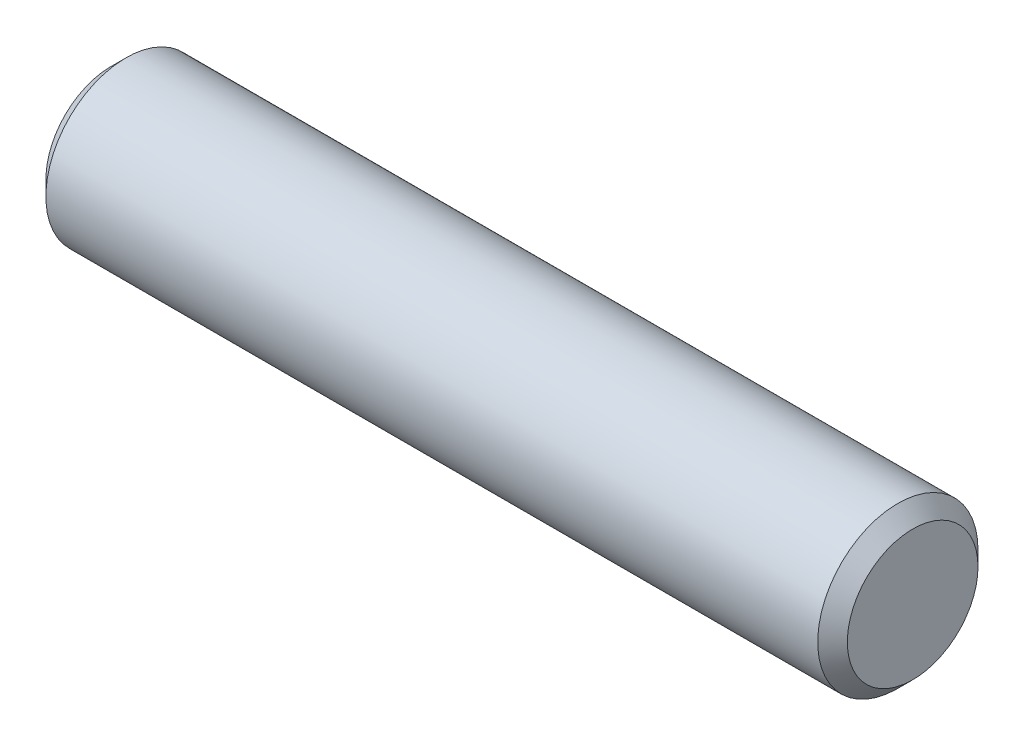
from build123d import *

# Parameters (mm, degrees)
BODYSKE_W     = 30
BODYSKE_H     = 3
CHAMFER1_SIZE = 0.5545


with BuildPart() as part:
    # BodySke → BaseBody (revolve)
    with BuildSketch(Plane.XY, mode=Mode.PRIVATE) as basebody_sk:
        with Locations((15, 1.5)):
            Rectangle(BODYSKE_W, BODYSKE_H)
    revolve(basebody_sk.sketch.rotate(Axis((-3.175, 0, 0), (1, 0, 0)), 90), axis=Axis((-3.175, 0, 0), (1, 0, 0)))

    # Chamfer1
    chamfer1_edges = [part.edges().sort_by_distance(p)[0] for p in [
        (30, 0, -3),
        (0, 0, -3),
    ]]
    chamfer(chamfer1_edges, length=CHAMFER1_SIZE)


solid = part.part
